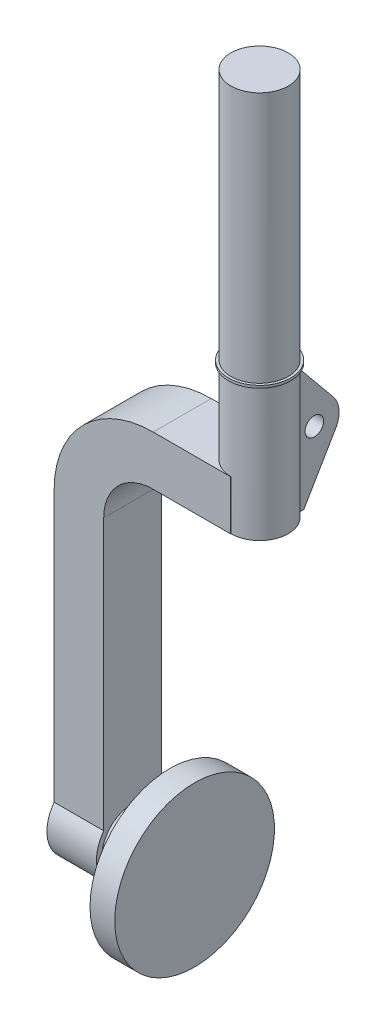
from build123d import *

# Parameters (mm, degrees)
BOSS_EXTRUDE1_DEPTH = 29.765625
SKETCH3_R           = 29.464
OLEOPIST_DEPTH      = 397.764
SKETCH5_R           = 32.004
REFMAXOLEO_DEPTH    = 2.54
SKETCH7_R           = 9.525
BOSS_EXTRUDE4_DEPTH = 15.875


with BuildPart() as part:
    # Sketch1 → Boss-Extrude1 (new, symmetric)
    with BuildSketch(Plane.XY):
        with BuildLine():
            Line((-114.3, -150.1775), (-114.3, 150.1775))
            ThreePointArc((-114.3, 150.1775), (-99.421024484, 186.098524484), (-63.5, 200.9775))
            Line((-63.5, 200.9775), (15.875, 200.9775))
            Line((15.875, 200.9775), (15.875, 251.7775))
            Line((15.875, 251.7775), (-63.5, 251.7775))
            ThreePointArc((-63.5, 251.7775), (-135.342048969, 222.019548969), (-165.1, 150.1775))
            Line((-165.1, 150.1775), (-165.1, -150.1775))
            Line((-165.1, -150.1775), (-114.3, -150.1775))
        make_face()
    extrude(amount=BOSS_EXTRUDE1_DEPTH, both=True)

    # Sketch2 → Revolve1 (revolve)
    with BuildSketch(Plane.XZ.offset(150.1775)):
        Polygon((-165.1, 0), (-114.3, 0), (-50.8, 0), (-50.8, 81.915), (-76.2, 81.915), (-76.2, 31.75), (-114.3, 31.75), (-114.3, 37.20703125), (-165.1, 37.20703125), align=None)
    revolve(axis=Axis((-165.1, -150.1775, 0), (1, 0, 0)))

    # Sketch3 → OleoPist (add)
    with BuildSketch(Plane.XZ.offset(-200.9775)):
        with Locations(Location((15.875, 0, 0), (0, 0, 237.398482094))):
            Circle(SKETCH3_R)
    extrude(amount=-OLEOPIST_DEPTH)

    # Sketch5 → RefMaxOleo (add)
    with BuildSketch(Plane(origin=(0, 340.6775, 0), x_dir=(1, 0, 0), z_dir=(0, 1, 0))):
        with Locations(Location((15.875, 0, 0), (0, 0, 180))):
            Circle(SKETCH5_R)
    extrude(amount=-REFMAXOLEO_DEPTH)

    # Sketch7 → Boss-Extrude4 (add, symmetric)
    with BuildSketch(Plane(origin=(15.875, -150.1775, 0), x_dir=(0, 0, -1), z_dir=(1, 0, 0))):
        with BuildLine():
            Line((16.764, 488.315), (59.880363403, 435.864541166))
            ThreePointArc((59.880363403, 435.864541166), (65.58043358, 421.731246842), (62.165446707, 406.879355611))
            Line((62.165446707, 406.879355611), (29.464, 351.155))
            Line((29.464, 351.155), (16.764, 351.155))
            Line((16.764, 351.155), (16.764, 488.315))
        make_face()
        with Locations((40.259, 419.735)):
            Circle(SKETCH7_R, mode=Mode.SUBTRACT)
    extrude(amount=BOSS_EXTRUDE4_DEPTH, both=True)


solid = part.part
